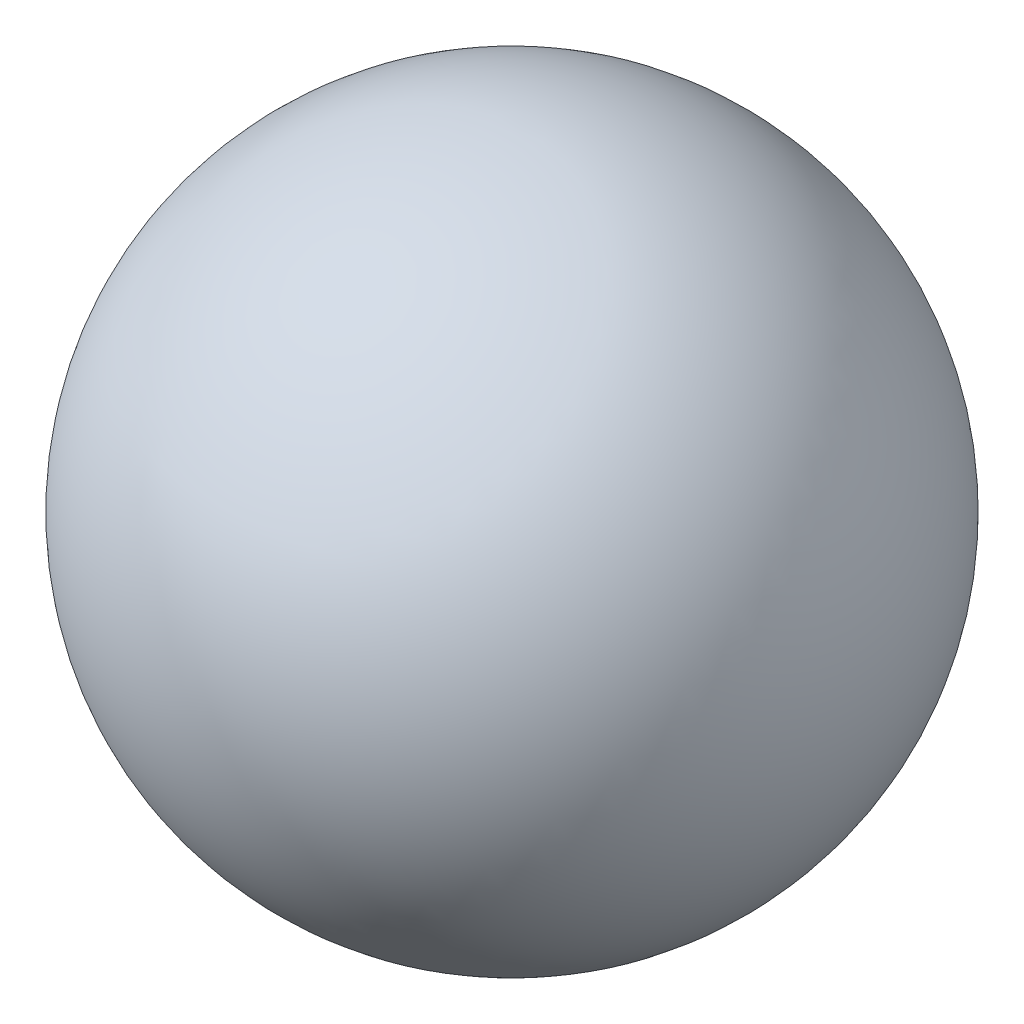
from build123d import *


with BuildPart() as part:
    # Sketch1 → Revolve1 (revolve)
    with BuildSketch(Plane.XY):
        with BuildLine():
            Line((0, -18), (0, 18))
            ThreePointArc((0, 18), (18, 0), (0, -18))
        make_face()
    revolve(axis=Axis((0, -18, 0), (0, 1, 0)))


solid = part.part
